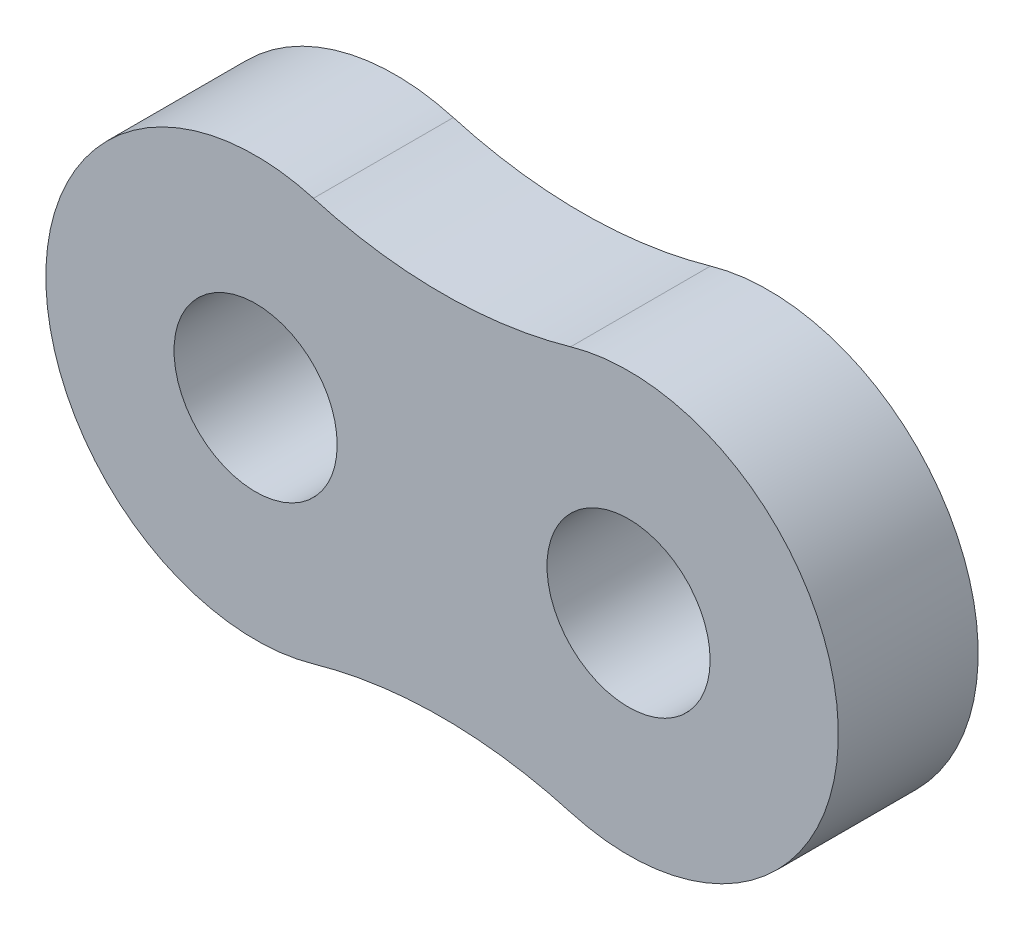
from build123d import *

# Parameters (mm, degrees)
SKETCH_1_R      = 4.5
SKETCH_1_R_2    = 1.75
EXTRUDE_1_DEPTH = 3
FILLET_1_R      = 10


with BuildPart() as part:
    # Эскиз1 → Бобышка-Вытянуть1 (new body)
    # profile 1 of 2: a face of its own
    with BuildSketch(Plane.XY):
        Circle(SKETCH_1_R)
        Circle(SKETCH_1_R_2, mode=Mode.SUBTRACT)
    # profile 2 of 2: a face of its own
    with BuildSketch(Plane.XY):
        with Locations((8, 0)):
            Circle(SKETCH_1_R)
        with Locations((8, 0)):
            Circle(SKETCH_1_R_2, mode=Mode.SUBTRACT)
    extrude(amount=EXTRUDE_1_DEPTH)

    # Скругление1
    fillet_1_edges = [part.edges().sort_by_distance(p)[0] for p in [
        (4, 2.061552813, 1.5),
        (4, -2.061552813, 1.5),
    ]]
    fillet(fillet_1_edges, radius=FILLET_1_R)


solid = part.part
